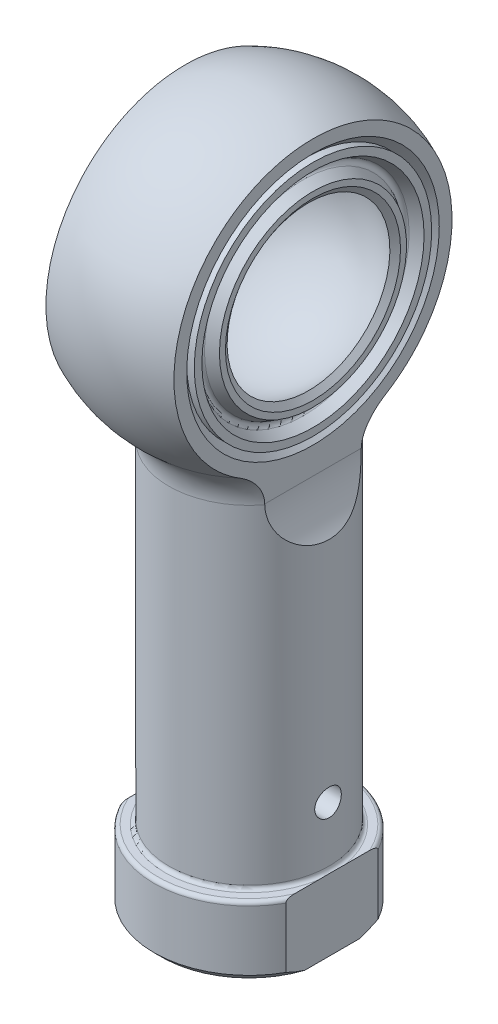
from build123d import *

# Parameters (mm, degrees)
CHAMFER1_SIZE           = 0.508
FILLET1_R               = 3.048
FILLET2_R               = 0.254
CUT_EXTRUDE1_DEPTH      = 50.7036011
CUT_EXTRUDE1_DEPTH_BACK = 50.7036011
SKETCH2_OUTSIDE_W       = 33.606
SKETCH2_OUTSIDE_H       = 60.683
CUT_EXTRUDE2_DEPTH      = 49.953749223
CUT_EXTRUDE2_DEPTH_BACK = 49.953749223
SKETCH3_R               = 7.9375
SKETCH3_R_2             = 0.889
CHAMFER2_SIZE           = 0.508


with BuildPart() as part:
    # Sketch1 → Revolve1 (revolve)
    with BuildSketch(Plane.XY, mode=Mode.PRIVATE) as revolve1_sk:
        with BuildLine():
            Line((3.571875, 0), (6.35, 0))
            Line((6.35, 0), (6.35, 4.7752))
            Line((6.35, 4.7752), (5.3594, 4.7752))
            Line((5.3594, 4.7752), (5.3594, 28.591555219))
            ThreePointArc((5.3594, 28.591555219), (9.850130685, 40.097329058), (0, 47.5488))
            Line((0, 47.5488), (0, 37.3126))
            Line((0, 37.3126), (0.889, 36.4236))
            Line((0.889, 36.4236), (0.889, 23.684415336))
            Line((0.889, 23.684415336), (3.317875, 22.225))
            Line((3.317875, 22.225), (3.317875, 19.05))
            Line((3.317875, 19.05), (3.571875, 19.05))
            Line((3.571875, 19.05), (3.571875, 0))
        make_face()
    revolve(revolve1_sk.sketch.rotate(Axis((0, -1004.593899687, 0), (0, 1, 0)), 90), axis=Axis((0, -1004.593899687, 0), (0, 1, 0)))

    # Chamfer1
    chamfer1_edges = [part.edges().sort_by_distance(p)[0] for p in [
        (0, 0, 6.35),
    ]]
    chamfer(chamfer1_edges, length=CHAMFER1_SIZE)

    # Fillet1
    fillet1_edges = [part.edges().sort_by_distance(p)[0] for p in [
        (0, 28.591555219, 5.3594),
    ]]
    fillet(fillet1_edges, radius=FILLET1_R)

    # Fillet2
    fillet2_edges = [part.edges().sort_by_distance(p)[0] for p in [
        (0, 4.7752, 6.35),
        (0, 4.7752, 5.3594),
    ]]
    fillet(fillet2_edges, radius=FILLET2_R)

    # Sketch2 outside → Cut-Extrude1 (cut, two sides: drawn at the far end of the back side and taken through both)
    with BuildSketch(Plane.XY.offset(-CUT_EXTRUDE1_DEPTH_BACK)):
        with Locations((0, 23.7745)):
            Rectangle(SKETCH2_OUTSIDE_W, SKETCH2_OUTSIDE_H)
        with BuildLine():
            Line((-5.5499, 0), (5.5499, 0))
            Line((5.5499, 0), (5.5499, 23.716295835))
            ThreePointArc((5.5499, 23.716295835), (4.607995119, 25.280348776), (4.2799, 27.0764))
            Line((4.2799, 27.0764), (4.2799, 47.5488))
            Line((4.2799, 47.5488), (-4.2799, 47.5488))
            Line((-4.2799, 47.5488), (-4.2799, 27.0764))
            ThreePointArc((-4.2799, 27.0764), (-4.607995119, 25.280348776), (-5.5499, 23.716295835))
            Line((-5.5499, 23.716295835), (-5.5499, 0))
        make_face(mode=Mode.SUBTRACT)
    extrude(amount=CUT_EXTRUDE1_DEPTH + CUT_EXTRUDE1_DEPTH_BACK, mode=Mode.SUBTRACT)

    # Sketch3 → Cut-Extrude2 (cut, two sides: drawn at the far end of the back side and taken through both)
    with BuildSketch(Plane(origin=(0, 0, 0), x_dir=(0, 0, -1), z_dir=(1, 0, 0)).offset(-CUT_EXTRUDE2_DEPTH_BACK)):
        with Locations(Location((0, 37.3126, 0), (0, 0, 90))):
            Circle(SKETCH3_R)
        with Locations((0, 8.71855)):
            Circle(SKETCH3_R_2)
    extrude(amount=CUT_EXTRUDE2_DEPTH + CUT_EXTRUDE2_DEPTH_BACK, mode=Mode.SUBTRACT)

    # Chamfer2
    chamfer2_edges = [part.edges().sort_by_distance(p)[0] for p in [
        (4.2799, 29.3751, 0),
        (-4.2799, 29.3751, 0),
    ]]
    chamfer(chamfer2_edges, length=CHAMFER2_SIZE)


with BuildPart() as body_2:
    # Sketch4 → Revolve2 (revolve)
    with BuildSketch(Plane.XY, mode=Mode.PRIVATE) as revolve2_sk:
        with BuildLine():
            Line((3.980082137, 42.756535697), (4.2799, 43.166625015))
            Line((4.2799, 43.166625015), (4.2799, 43.568924253))
            Line((4.2799, 43.568924253), (3.6449, 43.935541674))
            ThreePointArc((3.6449, 43.935541674), (3.5179, 44.155512127), (3.6449, 44.375482579))
            Line((3.6449, 44.375482579), (4.2799, 44.7421))
            Line((4.2799, 44.7421), (4.2799, 45.2501))
            Line((4.2799, 45.2501), (-4.2799, 45.2501))
            Line((-4.2799, 45.2501), (-4.2799, 44.7421))
            Line((-4.2799, 44.7421), (-3.6449, 44.375482579))
            ThreePointArc((-3.6449, 44.375482579), (-3.5179, 44.155512127), (-3.6449, 43.935541674))
            Line((-3.6449, 43.935541674), (-4.2799, 43.568924253))
            Line((-4.2799, 43.568924253), (-4.2799, 43.166625015))
            Line((-4.2799, 43.166625015), (-3.980082137, 42.756535697))
            ThreePointArc((-3.980082137, 42.756535697), (0, 44.0563), (3.980082137, 42.756535697))
        make_face()
    revolve(revolve2_sk.sketch.rotate(Axis((-14.449204668, 37.3126, 0), (1, 0, 0)), 90), axis=Axis((-14.449204668, 37.3126, 0), (1, 0, 0)))


solid = Compound([part.part, body_2.part])
